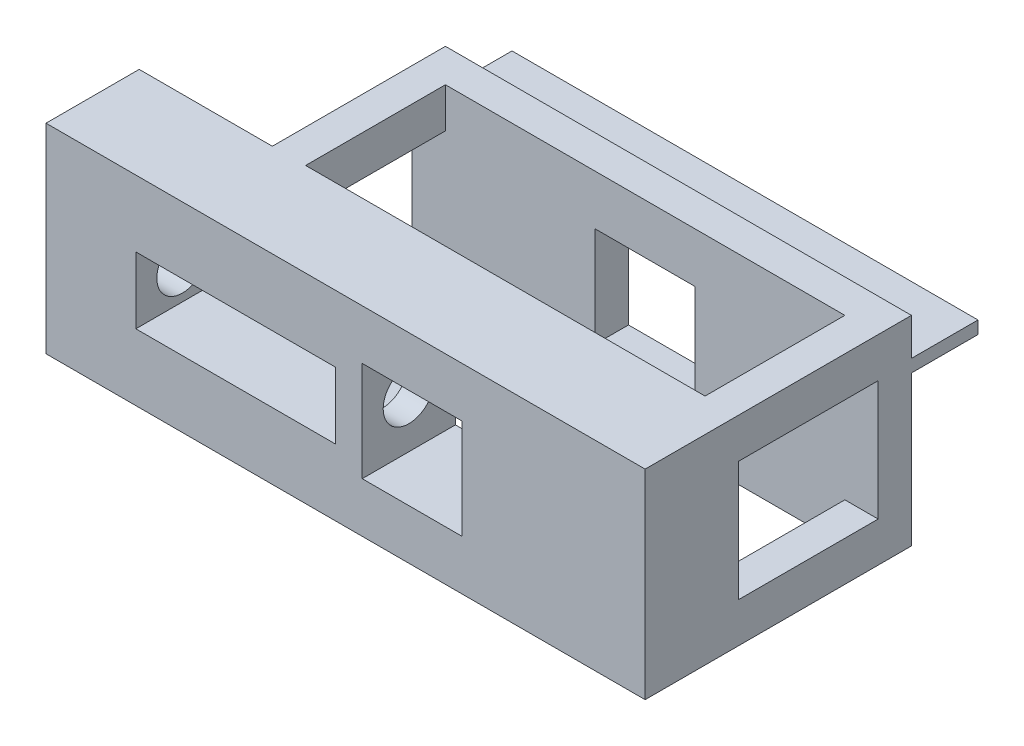
from build123d import *

# Parameters (mm, degrees)
SKETCH1_W                = 88.9
SKETCH1_H                = 38.1
SKETCH1_W_2              = 25.4
BOSS_EXTRUDE1_DEPTH      = 17.78
SKETCH2_W                = 38.1
SKETCH2_H                = 12.7
SKETCH2_W_2              = 6.35
SKETCH2_H_2              = 7.62
SKETCH2_W_3              = 19.05
SKETCH2_H_3              = 19.05
CUT_EXTRUDE1_DEPTH       = 41.402
SKETCH3_W                = 19.05
SKETCH3_H                = 19.05
BOSS_EXTRUDE2_DEPTH      = 6.35
SPRINGPLUNGER_HOLE_REACH = 132.755
SKETCH6_R                = 4.8895
SKETCH8_W                = 6.35
SKETCH8_H                = 7.62
SUPPORT_DEPTH            = 50.8
SKETCH10_W               = 88.9
SKETCH10_H               = 2.413
BOSS_EXTRUDE3_DEPTH      = 12.7


with BuildPart() as part:
    # Sketch1 → Boss-Extrude1 (new body)
    with BuildSketch(Plane.XY):
        with Locations((44.45, 19.05)):
            Rectangle(SKETCH1_W, SKETCH1_H)
        with Locations((-12.7, 19.05)):
            Rectangle(SKETCH1_W_2, SKETCH1_H)
    extrude(amount=-BOSS_EXTRUDE1_DEPTH)

    # Sketch2 → Cut-Extrude1 (cut)
    with BuildSketch(Plane.XY):
        with Locations((10.795, 19.05)):
            Rectangle(SKETCH2_W, SKETCH2_H)
        with Locations((3.175, 34.29)):
            Rectangle(SKETCH2_W_2, SKETCH2_H_2)
        with Locations((3.175, 3.81)):
            Rectangle(SKETCH2_W_2, SKETCH2_H_2)
        with Locations((44.45, 19.05)):
            Rectangle(SKETCH2_W_3, SKETCH2_H_3)
        with Locations((85.725, 34.29)):
            Rectangle(SKETCH2_W_2, SKETCH2_H_2)
        with Locations((85.725, 3.81)):
            Rectangle(SKETCH2_W_2, SKETCH2_H_2)
    extrude(amount=-CUT_EXTRUDE1_DEPTH, mode=Mode.SUBTRACT)

    # SpringPlunger Hole: up to this face of the body (flat: up to its plane)
    springplunger_hole_end = Plane(part.part.faces().sort_by_distance((34.925, 19.05, -8.89))[0])
    # Sketch6 → SpringPlunger Hole (cut, up to the picked face)
    with BuildSketch(Plane.ZY.offset(25.4), mode=Mode.PRIVATE) as springplunger_hole_sk1:
        with Locations((-8.89, 19.05)):
            Circle(SKETCH6_R)
    springplunger_hole_tool1 = split(extrude(springplunger_hole_sk1.sketch, amount=-SPRINGPLUNGER_HOLE_REACH, mode=Mode.PRIVATE), bisect_by=springplunger_hole_end, keep=Keep.BOTH, mode=Mode.PRIVATE)
    add(springplunger_hole_tool1.solids().sort_by(Axis((-25.4, 19.05, -8.89), (1, 0, 0)))[0], mode=Mode.SUBTRACT)



with BuildPart() as body_2:
    # Sketch3 → Boss-Extrude2 (new body)
    with BuildSketch(Plane.XY.offset(-50.8)):
        Polygon((0, 30.48), (0, 7.62), (6.35, 7.62), (6.35, 0), (82.55, 0), (82.55, 7.62), (88.9, 7.62), (88.9, 30.48), (82.55, 30.48), (82.55, 38.1), (6.35, 38.1), (6.35, 30.48), align=None)
        with Locations((44.45, 19.05)):
            Rectangle(SKETCH3_W, SKETCH3_H, mode=Mode.SUBTRACT)
    extrude(amount=BOSS_EXTRUDE2_DEPTH)


with BuildPart() as part_1:
    add(part.part)

    add(body_2.part)  # Support merges body 2
    # Sketch8 → Support (add)
    with BuildSketch(Plane.XY):
        with Locations((3.175, 34.29)):
            Rectangle(SKETCH8_W, SKETCH8_H)
        with Locations((85.725, 34.29)):
            Rectangle(SKETCH8_W, SKETCH8_H)
        with Locations((85.725, 3.81)):
            Rectangle(SKETCH8_W, SKETCH8_H)
        with Locations((3.175, 3.81)):
            Rectangle(SKETCH8_W, SKETCH8_H)
    extrude(amount=-SUPPORT_DEPTH)

    # Sketch10 → Boss-Extrude3 (add)
    with BuildSketch(Plane(origin=(0, 0, -50.8), x_dir=(-1, 0, 0), z_dir=(0, 0, -1))):
        with Locations((-44.45, 29.7815)):
            Rectangle(SKETCH10_W, SKETCH10_H)
    extrude(amount=BOSS_EXTRUDE3_DEPTH)


solid = part_1.part
